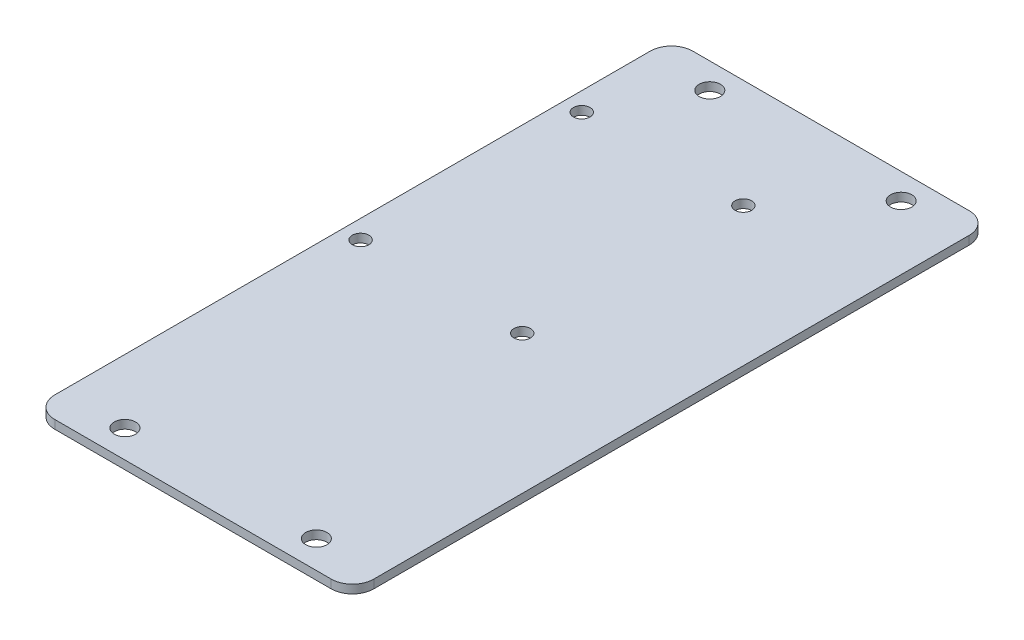
from build123d import *

# Parameters (mm, degrees)
SKETCH1_W           = 95.25
SKETCH1_H           = 190.5
SKETCH1_R           = 2.4765
SKETCH1_R_2         = 3.175
BOSS_EXTRUDE1_DEPTH = 2.54
FILLET1_R           = 6.35


with BuildPart() as part:
    # Sketch1 → Boss-Extrude1 (new body)
    with BuildSketch(Plane(origin=(0, 0, 0), x_dir=(1, 0, 0), z_dir=(0, 1, 0))):
        Rectangle(SKETCH1_W, SKETCH1_H)
        with Locations(Location((-42.037, 62.865, 0), (0, 0, 270))):
            Circle(SKETCH1_R, mode=Mode.SUBTRACT)
        with Locations(Location((6.223, 62.865, 0), (0, 0, 270))):
            Circle(SKETCH1_R, mode=Mode.SUBTRACT)
        with Locations(Location((6.223, -3.175, 0), (0, 0, 270))):
            Circle(SKETCH1_R, mode=Mode.SUBTRACT)
        with Locations(Location((-42.037, -3.175, 0), (0, 0, 270))):
            Circle(SKETCH1_R, mode=Mode.SUBTRACT)
        with Locations(Location((-28.575, 87.63, 0), (0, 0, 270))):
            Circle(SKETCH1_R_2, mode=Mode.SUBTRACT)
        with Locations(Location((28.575, 87.63, 0), (0, 0, 270))):
            Circle(SKETCH1_R_2, mode=Mode.SUBTRACT)
        with Locations(Location((28.575, -86.995, 0), (0, 0, 270))):
            Circle(SKETCH1_R_2, mode=Mode.SUBTRACT)
        with Locations(Location((-28.575, -86.995, 0), (0, 0, 270))):
            Circle(SKETCH1_R_2, mode=Mode.SUBTRACT)
    extrude(amount=BOSS_EXTRUDE1_DEPTH)

    # Fillet1
    fillet1_edges = [part.edges().sort_by_distance(p)[0] for p in [
        (47.625, 1.27, 95.25),
        (-47.625, 1.27, 95.25),
        (-47.625, 1.27, -95.25),
        (47.625, 1.27, -95.25),
    ]]
    fillet(fillet1_edges, radius=FILLET1_R)


solid = part.part
